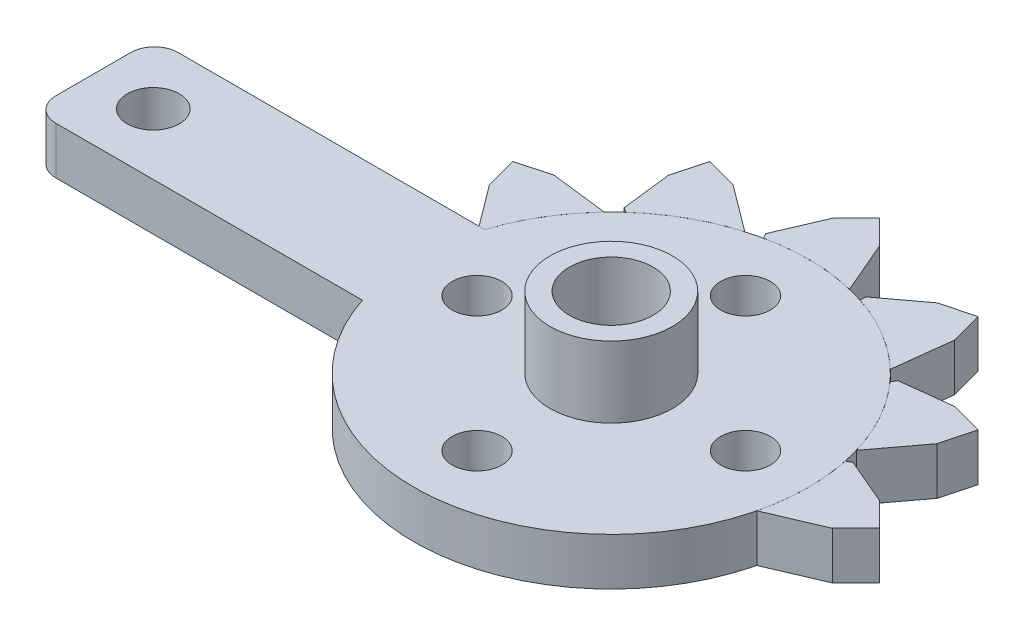
from build123d import *

# Parameters (mm, degrees)
SKETCH1_R             = 1.575
SKETCH1_R_2           = 3.875
SKETCH1_R_3           = 1.65
BOSS_EXTRUDE1_DEPTH   = 3
SKETCH1_R_4           = 3
SKETCH1_R_5           = 2.65
BOSS_EXTRUDE1_2_DEPTH = 3
SKETCH1_3_R           = 3.875
SKETCH1_3_R_2         = 2.65
BOSS_EXTRUDE2_DEPTH   = 7.5
BOSS_EXTRUDE3_DEPTH   = 3
FILLET2_R             = 1.5
CIRPATTERN2_COUNT     = 6
CIRPATTERN2_ANGLE     = 150
BOSS_EXTRUDE4_START   = 3
BOSS_EXTRUDE4_DEPTH   = 0.75


with BuildPart() as part:
    # Sketch1 → Boss-Extrude1 (new body)
    with BuildSketch(Plane(origin=(0, 0, 0), x_dir=(1, 0, 0), z_dir=(0, 1, 0))):
        with BuildLine():
            ThreePointArc((-11.884206957, -3.875), (12.5, 0), (-11.884206957, 3.875))
            Line((-11.884206957, 3.875), (-32.8, 3.875))
            Line((-32.8, 3.875), (-32.8, -3.875))
            Line((-32.8, -3.875), (-11.884206957, -3.875))
        make_face()
        with Locations(Location((0, -8.5, 0), (0, 0, 270))):
            Circle(SKETCH1_R, mode=Mode.SUBTRACT)
        with Locations(Location((-8.5, 0, 0), (0, 0, 270))):
            Circle(SKETCH1_R, mode=Mode.SUBTRACT)
        with Locations(Location((0, 0, 0), (0, 0, 270))):
            Circle(SKETCH1_R_2, mode=Mode.SUBTRACT)
        with Locations(Location((0, 8.5, 0), (0, 0, 270))):
            Circle(SKETCH1_R, mode=Mode.SUBTRACT)
        with Locations(Location((8.5, 0, 0), (0, 0, 270))):
            Circle(SKETCH1_R, mode=Mode.SUBTRACT)
        with Locations(Location((-29, 0, 0), (0, 0, 270))):
            Circle(SKETCH1_R_3, mode=Mode.SUBTRACT)
    extrude(amount=BOSS_EXTRUDE1_DEPTH)

    # Sketch1<3> → Boss-Extrude2 (add)
    with BuildSketch(Plane(origin=(0, 0, 0), x_dir=(1, 0, 0), z_dir=(0, 1, 0))):
        with Locations(Location((0, 0, 0), (0, 0, 270))):
            Circle(SKETCH1_3_R)
        with Locations(Location((0, 0, 0), (0, 0, 270))):
            Circle(SKETCH1_3_R_2, mode=Mode.SUBTRACT)
    extrude(amount=BOSS_EXTRUDE2_DEPTH)

    # Fillet2
    fillet2_edges = [part.edges().sort_by_distance(p)[0] for p in [
        (-32.8, 1.5, 3.875),
        (-32.8, 1.5, -3.875),
    ]]
    fillet(fillet2_edges, radius=FILLET2_R)



with BuildPart() as body_2:
    # Sketch1 → Boss-Extrude1 2 (new body)
    with BuildSketch(Plane(origin=(0, 0, 0), x_dir=(1, 0, 0), z_dir=(0, 1, 0))):
        with Locations(Location((0, 0, 0), (0, 0, 270))):
            Circle(SKETCH1_R_4)
        with Locations(Location((0, 0, 0), (0, 0, 270))):
            Circle(SKETCH1_R_5, mode=Mode.SUBTRACT)
    extrude(amount=BOSS_EXTRUDE1_2_DEPTH)


with BuildPart() as body_3:
    # Sketch5 → Boss-Extrude3 (new body)
    with BuildSketch(Plane(origin=(0, 3, 0), x_dir=(1, 0, 0), z_dir=(0, 1, 0))):
        Polygon((-13.873813669, 6.971333545), (-14.174036226, 6.451332823), (-12.246285838, 3.875), (-12.154926609, 3.875), align=None)
        Polygon((-14.722431864, 8.5), (-14.174036226, 6.451332823), (-13.873813669, 6.971333545), align=None)
        Polygon((-13.424036226, 7.750370929), (-14.722431864, 8.5), (-13.873813669, 6.971333545), align=None)
        Polygon((-12.974258783, 8.529408312), (-14.722431864, 8.5), (-13.424036226, 7.750370929), align=None)
        Polygon((-12.674036226, 9.049409034), (-14.722431864, 8.5), (-12.974258783, 8.529408312), align=None)
        with BuildLine():
            Line((-9.054791078, 8.617468221), (-12.674036226, 9.049409034))
            Line((-12.674036226, 9.049409034), (-12.974258783, 8.529408312))
            Line((-12.974258783, 8.529408312), (-9.076136543, 8.594983737))
            ThreePointArc((-9.076136543, 8.594983737), (-9.065470782, 8.606232597), (-9.054791078, 8.617468221))
        make_face()
        with BuildLine():
            Line((-9.076136543, 8.594983737), (-12.974258783, 8.529408312))
            Line((-12.974258783, 8.529408312), (-13.424036226, 7.750370929))
            Line((-13.424036226, 7.750370929), (-10.825317547, 6.25))
            ThreePointArc((-10.825317547, 6.25), (-10.019566154, 7.473840652), (-9.076136543, 8.594983737))
        make_face()
        with BuildLine():
            Line((-13.424036226, 7.750370929), (-13.873813669, 6.971333545))
            Line((-13.873813669, 6.971333545), (-12.154926609, 3.875))
            Line((-12.154926609, 3.875), (-11.884206957, 3.875))
            ThreePointArc((-11.884206957, 3.875), (-11.416688752, 5.090109817), (-10.825317547, 6.25))
            Line((-10.825317547, 6.25), (-13.424036226, 7.750370929))
        make_face()
    extrude(amount=-BOSS_EXTRUDE3_DEPTH)


with BuildPart() as cirpattern2_1:
    # CirPattern2: pattern copy
    add(body_3.part.rotate(Axis((0, 0, 0), (0, -1, 0)), 1 * CIRPATTERN2_ANGLE / (CIRPATTERN2_COUNT - 1)))


with BuildPart() as cirpattern2_2:
    # CirPattern2: pattern copy
    add(body_3.part.rotate(Axis((0, 0, 0), (0, -1, 0)), 2 * CIRPATTERN2_ANGLE / (CIRPATTERN2_COUNT - 1)))


with BuildPart() as cirpattern2_3:
    # CirPattern2: pattern copy
    add(body_3.part.rotate(Axis((0, 0, 0), (0, -1, 0)), 3 * CIRPATTERN2_ANGLE / (CIRPATTERN2_COUNT - 1)))


with BuildPart() as cirpattern2_4:
    # CirPattern2: pattern copy
    add(body_3.part.rotate(Axis((0, 0, 0), (0, -1, 0)), 4 * CIRPATTERN2_ANGLE / (CIRPATTERN2_COUNT - 1)))


with BuildPart() as cirpattern2_5:
    # CirPattern2: pattern copy
    add(body_3.part.rotate(Axis((0, 0, 0), (0, -1, 0)), 5 * CIRPATTERN2_ANGLE / (CIRPATTERN2_COUNT - 1)))


with BuildPart() as part_1:
    add(part.part)

    add(body_2.part)  # Boss-Extrude4 merges body 2
    # Sketch1<5> → Boss-Extrude4 (add)
    with BuildSketch(Plane(origin=(0, 0, 0), x_dir=(1, 0, 0), z_dir=(0, 1, 0)).offset(BOSS_EXTRUDE4_START)):
        with BuildLine():
            ThreePointArc((0, 2.65), (-1.87383297, 1.87383297), (-2.65, 0))
            Line((-2.65, 0), (-1.125, 0))
            ThreePointArc((-1.125, 0), (-0.795495129, 0.795495129), (0, 1.125))
            Line((0, 1.125), (0, 2.65))
        make_face()
        with BuildLine():
            Line((-1.125, 0), (-2.65, 0))
            ThreePointArc((-2.65, 0), (0, -2.65), (2.65, 0))
            ThreePointArc((2.65, 0), (1.87383297, 1.87383297), (0, 2.65))
            Line((0, 2.65), (0, 1.125))
            ThreePointArc((0, 1.125), (0.795495129, 0.795495129), (1.125, 0))
            ThreePointArc((1.125, 0), (0, -1.125), (-1.125, 0))
        make_face()
    extrude(amount=BOSS_EXTRUDE4_DEPTH)


solid = Compound([body_3.part, cirpattern2_1.part, cirpattern2_2.part, cirpattern2_3.part, cirpattern2_4.part, cirpattern2_5.part, part_1.part])
